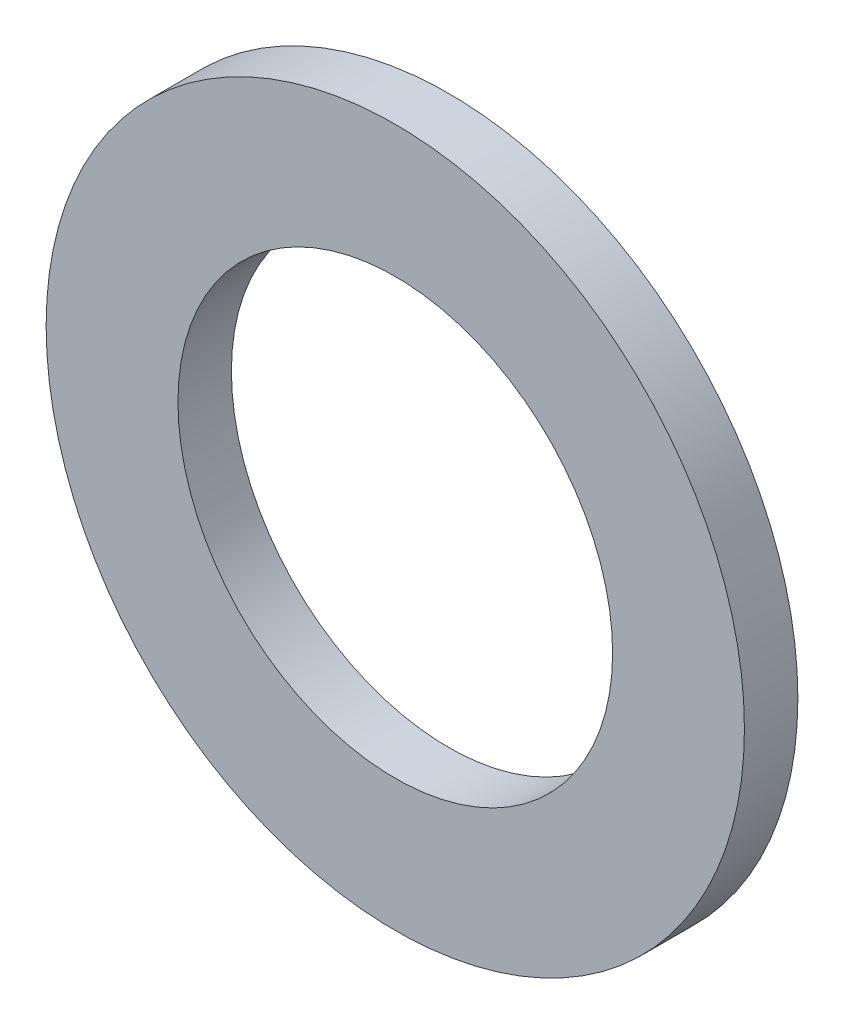
from build123d import *

# Parameters (mm, degrees)
ESQUISSE1_R      = 9.8
ESQUISSE1_R_2    = 6.1
EXTRUSION1_DEPTH = 1.5


with BuildPart() as part:
    # Esquisse1 → Extrusion1 (new body)
    with BuildSketch(Plane.XY):
        with Locations(Location((0, 0, 0), (0, 0, 180))):
            Circle(ESQUISSE1_R)
        with Locations(Location((0, 0, 0), (0, 0, 180))):
            Circle(ESQUISSE1_R_2, mode=Mode.SUBTRACT)
    extrude(amount=EXTRUSION1_DEPTH)


solid = part.part
